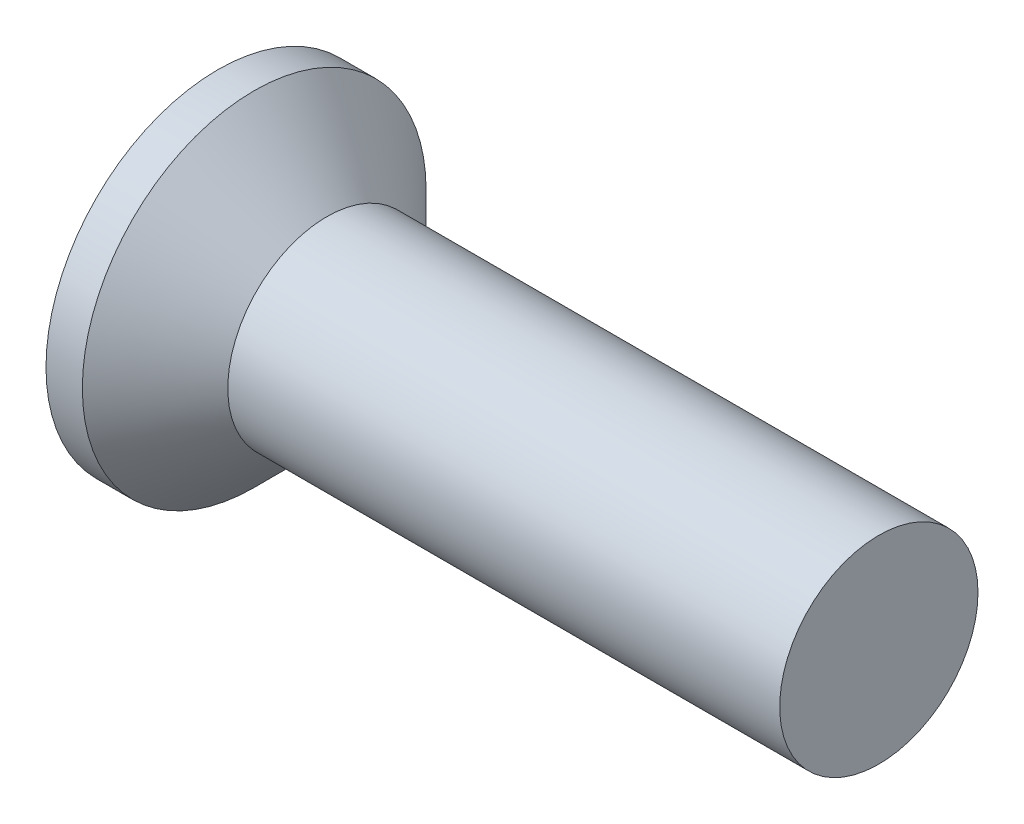
from build123d import *

# Parameters (mm, degrees)
CROSSRECESS_DEPTH = 0.825
DRAFT9_ANGLE      = 30
FILLET5_R         = 0.3


with BuildPart() as part:
    # Sketch1 → Base (revolve)
    with BuildSketch(Plane.XY, mode=Mode.PRIVATE) as base_sk:
        Polygon((10, 1.5), (2.65, 1.5), (1.65, 1.5), (0.55, 2.6), (0, 2.6), (0, 0), (10, 0), align=None)
    revolve(base_sk.sketch.rotate(Axis((4.515812911, 0, 0), (-1, 0, 0)), 90), axis=Axis((4.515812911, 0, 0), (-1, 0, 0)))

    # Sketch6 → CrossRecess (cut)
    with BuildSketch(Plane(origin=(0, 0, 0), x_dir=(0, 0, -1), z_dir=(1, 0, 0))):
        Polygon((0.32, 0.32), (0.32, 1.6), (-0.32, 1.6), (-0.32, 0.32), (-1.6, 0.32), (-1.6, -0.32), (-0.32, -0.32), (-0.32, -1.6), (0.32, -1.6), (0.32, -0.32), (1.6, -0.32), (1.6, 0.32), align=None)
    extrude(amount=CROSSRECESS_DEPTH, mode=Mode.SUBTRACT)

    # Draft9
    draft9_faces = [part.faces().sort_by_distance(p)[0] for p in [
        (0.4125, 1.6, 0),
        (0.4125, 0, 1.6),
        (0.4125, -1.6, 0),
        (0.4125, 0, -1.6),
    ]]
    draft(draft9_faces, Plane(origin=(0, 2.6, 0), x_dir=(0, 0, -1), z_dir=(-1, 0, 0)), DRAFT9_ANGLE)

    # Fillet5
    fillet5_edges = [part.edges().sort_by_distance(p)[0] for p in [
        (0.4125, 0.32, 0.32),
        (0.4125, -0.32, 0.32),
        (0.4125, -0.32, -0.32),
        (0.4125, 0.32, -0.32),
    ]]
    fillet(fillet5_edges, radius=FILLET5_R)


solid = part.part
